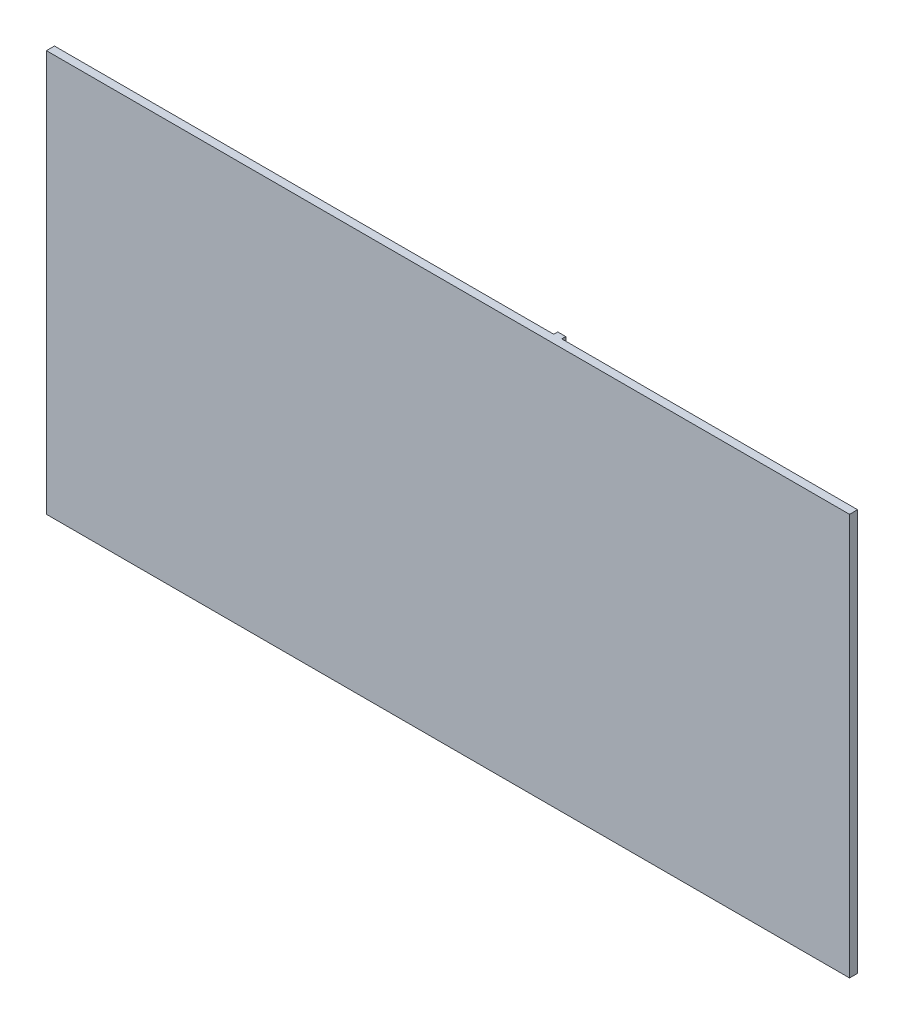
from build123d import *

# Parameters (mm, degrees)
SKETCH_1_W      = 1000
SKETCH_1_H      = 500
EXTRUDE_1_DEPTH = 10
SKETCH_2_W      = 10
SKETCH_2_H      = 500
EXTRUDE_2_DEPTH = 5


with BuildPart() as part:
    # 草图1 → 凸台-拉伸1 (new body)
    with BuildSketch(Plane.XY):
        Rectangle(SKETCH_1_W, SKETCH_1_H)
    extrude(amount=EXTRUDE_1_DEPTH)

    # 草图2 → 凸台-拉伸2 (add)
    with BuildSketch(Plane(origin=(0, 0, 0), x_dir=(-1, 0, 0), z_dir=(0, 0, -1))):
        with Locations((-126.636020437, 0)):
            Rectangle(SKETCH_2_W, SKETCH_2_H)
    extrude(amount=EXTRUDE_2_DEPTH)


solid = part.part
